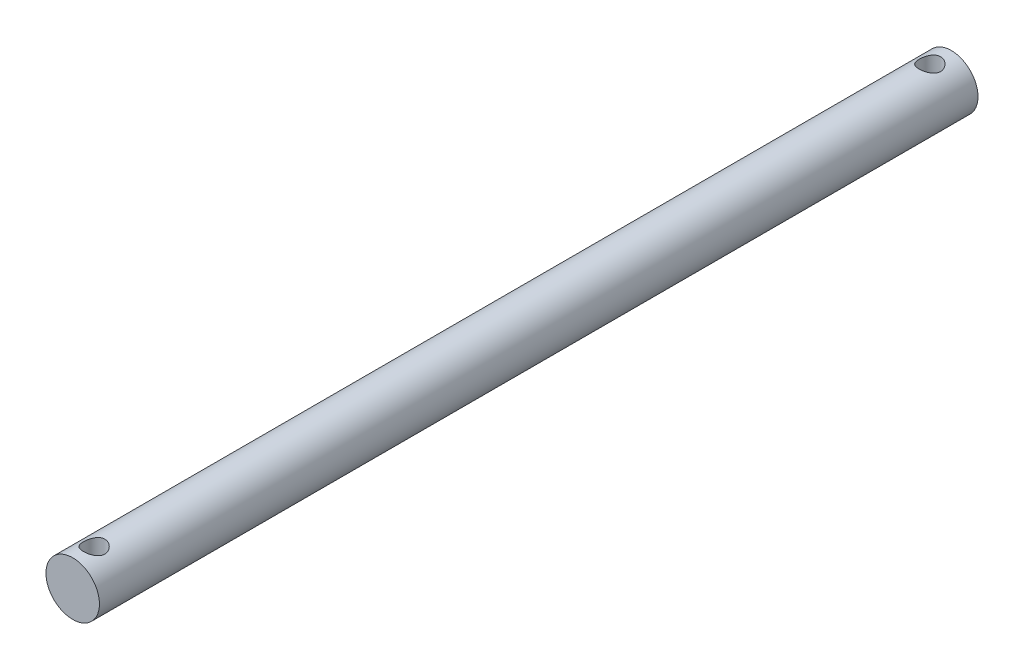
from build123d import *

# Parameters (mm, degrees)
CROQUIS1_R                 = 3.9624
SALIENTE_EXTRUIR1_DEPTH    = 130.175
CORTAR_EXTRUIR1_DEPTH      = 131.295555767
CORTAR_EXTRUIR1_DEPTH_BACK = 131.295555767
CROQUIS2_R                 = 1.5875


with BuildPart() as part:
    # Croquis1 → Saliente-Extruir1 (new body)
    with BuildSketch(Plane.XY):
        Circle(CROQUIS1_R)
    extrude(amount=SALIENTE_EXTRUIR1_DEPTH)

    # Croquis2 → Cortar-Extruir1 (cut, two sides: drawn at the far end of the back side and taken through both)
    with BuildSketch(Plane(origin=(0, 0, 0), x_dir=(1, 0, 0), z_dir=(0, 1, 0)).offset(-CORTAR_EXTRUIR1_DEPTH_BACK)):
        with Locations(Location((0, -127, 0), (0, 0, 270))):
            Circle(CROQUIS2_R)
        with Locations(Location((0, -3.175, 0), (0, 0, 270))):
            Circle(CROQUIS2_R)
    extrude(amount=CORTAR_EXTRUIR1_DEPTH + CORTAR_EXTRUIR1_DEPTH_BACK, mode=Mode.SUBTRACT)


solid = part.part
